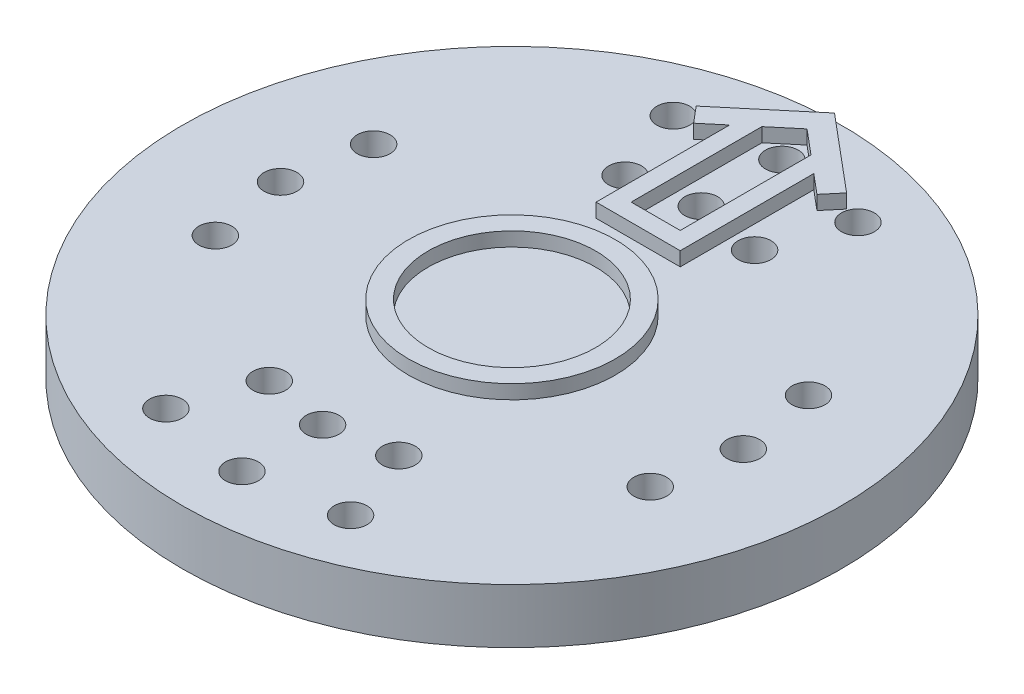
from build123d import *

# Parameters (mm, degrees)
SKETCH1_R                       = 11.938
EXTRUDE1_DEPTH                  = 1.9812
SKETCH2_R                       = 4.445
EXTRUDE2_DEPTH                  = 2.286
F_3_64_0_04688_DIAMETER_HOLE1_D = 1.190752
CIRPATTERN1_COUNT               = 2
SKETCH6_R                       = 3.7465
SKETCH6_R_2                     = 3.0353
EXTRUDE4_DEPTH                  = 0.508
EXTRUDE3_DEPTH                  = 0.508


with BuildPart() as part:
    # Sketch1 → Extrude1 (new body)
    with BuildSketch(Plane(origin=(0, 0, 0), x_dir=(1, 0, 0), z_dir=(0, 1, 0))):
        with Locations(Location((0, 0, 0), (0, 0, 270))):
            Circle(SKETCH1_R)
    extrude(amount=-EXTRUDE1_DEPTH)

    # Sketch2 → Extrude2 (add)
    with BuildSketch(Plane.XZ.offset(1.9812)):
        with Locations(Location((0, 0, 0), (0, 0, 90))):
            Circle(SKETCH2_R)
    extrude(amount=EXTRUDE2_DEPTH)

    # 3/64 (0.04688) Diameter Hole1 (through all)
    with Locations(Plane(origin=(0, 0, -6.858), x_dir=(0, 0, 1), z_dir=(0, 1, 0))):
        with Locations((0, 0), (0.413588007, -2.345574143), (0.413588007, 2.345574143), (-2.331254139, 3.344614982), (-2.921, 0), (-2.331254139, -3.344614982), (3.991187159, -7.876503547), (6.858, -8.382), (9.724812841, -7.876503547)):
            f_3_64_0_04688_diameter_hole1 = Hole(F_3_64_0_04688_DIAMETER_HOLE1_D / 2)

    # CirPattern1: 3/64 (0.04688) Diameter Hole1 ×2 about axis
    cirpattern1_axis = Axis((0, 0, 0), (0, 1, 0))
    for i in range(1, CIRPATTERN1_COUNT):
        add(f_3_64_0_04688_diameter_hole1.rotate(cirpattern1_axis, i * 360 / CIRPATTERN1_COUNT), mode=Mode.SUBTRACT)

    # Sketch6 → Extrude4 (add)
    with BuildSketch(Plane(origin=(0, 0, 0), x_dir=(1, 0, 0), z_dir=(0, 1, 0))):
        with Locations(Location((0, 0, 0), (0, 0, 270))):
            Circle(SKETCH6_R)
        with Locations(Location((0, 0, 0), (0, 0, 270))):
            Circle(SKETCH6_R_2, mode=Mode.SUBTRACT)
    extrude(amount=EXTRUDE4_DEPTH)

    # Sketch5 → Extrude3 (add)
    with BuildSketch(Plane(origin=(0, 0, 0), x_dir=(1, 0, 0), z_dir=(0, 1, 0))):
        Polygon((-2.72405404, 9.39824726), (0, 11.684), (2.72405404, 9.39824726), (2.234249881, 8.814521394), (1.524, 9.410491808), (1.524, 4.572), (-1.524, 4.572), (-1.524, 9.410491808), (-2.234249881, 8.814521394), align=None)
        Polygon((0, 10.689279646), (-0.889, 9.943320073), (-0.889, 5.207), (0.889, 5.207), (0.889, 9.943320073), align=None, mode=Mode.SUBTRACT)
    extrude(amount=EXTRUDE3_DEPTH)


solid = part.part
